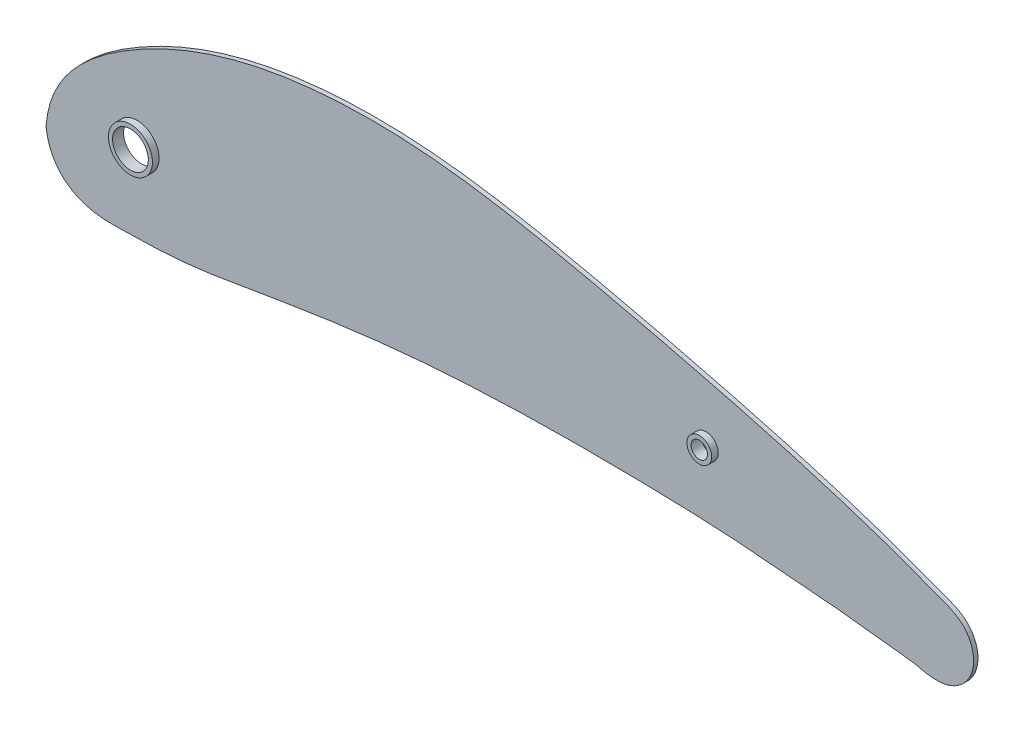
from build123d import *

# Parameters (mm, degrees)
BOSS_EXTRUDE1_DEPTH = 1.5875
SKETCH2_R           = 4.5
SKETCH2_R_2         = 3
SKETCH2_R_3         = 8
SKETCH2_R_4         = 6.5
BOSS_EXTRUDE2_DEPTH = 2.412500128
CUT_EXTRUDE1_START  = -4
SKETCH2_4_R         = 6.5
SKETCH2_4_R_2       = 5.75
SKETCH2_4_R_3       = 3
CUT_EXTRUDE1_DEPTH  = 4
SKETCH3_R           = 3
SKETCH3_R_2         = 6.5
BOSS_EXTRUDE3_DEPTH = 1.5875


with BuildPart() as part:
    # Sketch1 → Boss-Extrude1 (new body)
    with BuildSketch(Plane.XY):
        with BuildLine():
            add(Edge.make_bspline(
                [(0.000560351, 0.000130087), (0.810633127, 7.359196055), (8.649092025, 17.856605174), (26.286719818, 29.975176328), (52.111128271, 42.069215275), (89.597618475, 49.290763054), (131.400792109, 47.884831915), (173.256699242, 40.041104278), (217.961060472, 29.612974894), (256.952064401, 19.528920948), (290.35983767, 8.71099439), (301.273197721, 4.382828139), (314.816918223, -0.516206742), (309.846313895, 0.000130087)],
                knots=[0, 0, 0, 0, 0.060863618, 0.113688265, 0.188608742, 0.312908923, 0.448482434, 0.557612135, 0.691544113, 0.852438279, 0.92975597, 0.976058229, 1, 1, 1, 1], degree=3))
            add(Edge.make_bspline(
                [(309.846313895, 0.000130087), (303.956832565, 1.47095521), (293.989507544, 2.093987313), (276.26402299, 4.514356704), (260.846344817, 5.427413394), (235.858814759, 7.870306192), (205.101424636, 8.838080282), (157.718638092, 9.030650149), (110.497331172, 6.181495223), (66.506197185, -0.586669107), (36.454672816, -6.098499901), (15.316603331, -6.189065841), (1.230714189, -6.924076091), (0.000560351, 0.000130087)],
                knots=[0, 0, 0, 0, 0.057787081, 0.095274891, 0.171021118, 0.205339302, 0.335319146, 0.464904334, 0.658702312, 0.785511947, 0.893517288, 0.94309214, 1, 1, 1, 1], degree=3))
        make_face()
    extrude(amount=BOSS_EXTRUDE1_DEPTH)

    # Sketch2 → Boss-Extrude2 (add)
    # profile 1 of 2: a face of its own
    with BuildSketch(Plane.XY.offset(1.5875)):
        with Locations(Location((227.296313895, 19.050130087, 0), (0, 0, 180))):
            Circle(SKETCH2_R)
        with Locations((227.296313895, 19.050130087)):
            Circle(SKETCH2_R_2, mode=Mode.SUBTRACT)
    # profile 2 of 2: a face of its own
    with BuildSketch(Plane.XY.offset(1.5875)):
        with Locations(Location((20.32, 10.16, 0), (0, 0, 180))):
            Circle(SKETCH2_R_3)
        with Locations((20.32, 10.16)):
            Circle(SKETCH2_R_4, mode=Mode.SUBTRACT)
    extrude(amount=BOSS_EXTRUDE2_DEPTH)

    # Sketch2<4> → Cut-Extrude1 (cut)
    # profile 1 of 3: a face of its own
    with BuildSketch(Plane.XY.offset(1.5875).offset(CUT_EXTRUDE1_START)):
        with Locations(Location((20.32, 10.16, 0), (0, 0, 180))):
            Circle(SKETCH2_4_R)
        with Locations((20.32, 10.16)):
            Circle(SKETCH2_4_R_2, mode=Mode.SUBTRACT)
    # profile 2 of 3: a face of its own
    with BuildSketch(Plane.XY.offset(1.5875).offset(CUT_EXTRUDE1_START)):
        with Locations((20.32, 10.16)):
            Circle(SKETCH2_4_R_2)
    # profile 3 of 3: a face of its own
    with BuildSketch(Plane.XY.offset(1.5875).offset(CUT_EXTRUDE1_START)):
        with Locations(Location((227.296313895, 19.050130087, 0), (0, 0, 180))):
            Circle(SKETCH2_4_R_3)
    extrude(amount=CUT_EXTRUDE1_DEPTH, mode=Mode.SUBTRACT)

    # Sketch3 → Boss-Extrude3 (add)
    with BuildSketch(Plane(origin=(0, 0, 0), x_dir=(-1, 0, 0), z_dir=(0, 0, -1))):
        with BuildLine():
            add(Edge.make_bspline(
                [(-307.640659198, -12.539087546), (-307.217558356, -12.433423344), (-306.794698745, -12.325307987), (-305.94757969, -12.12330096), (-305.523307874, -12.029535003), (-304.248687144, -11.766580558), (-303.396542737, -11.615636043), (-300.835174159, -11.21295058), (-299.121107841, -11.010410608), (-295.688964286, -10.646085532), (-293.970839392, -10.484784679), (-291.395439154, -10.22467467), (-290.537293617, -10.134707532), (-288.822043271, -9.944198445), (-287.964861558, -9.844437915), (-285.39405881, -9.537612889), (-283.681197538, -9.322828465), (-280.253975137, -8.908499626), (-278.539352749, -8.711609867), (-273.38915432, -8.185272474), (-269.948888995, -7.903472556), (-263.065636854, -7.367525768), (-259.622642312, -7.113457385), (-252.743642855, -6.534299134), (-249.308438171, -6.201078142), (-242.431016007, -5.605893048), (-238.987786484, -5.354212306), (-232.093485223, -4.930535427), (-228.641544528, -4.75746758), (-218.28592219, -4.32759383), (-211.381766601, -4.15969745), (-197.573132458, -3.918001938), (-190.668647472, -3.846076469), (-176.859186388, -3.845312431), (-169.95421005, -3.916543553), (-156.143612339, -4.246938801), (-149.234937909, -4.505545645), (-135.436938869, -5.236314206), (-128.547026917, -5.708365191), (-114.787919071, -6.895625055), (-107.918875215, -7.612618486), (-94.20369313, -9.315463639), (-87.358999715, -10.294378281), (-77.115816219, -11.889039149), (-73.704718185, -12.441665778), (-66.887436207, -13.578332899), (-63.482024188, -14.167402421), (-53.261994425, -15.909749635), (-46.44242034, -17.028905731), (-37.85333306, -17.987330435), (-36.13227452, -18.1567188), (-32.688374655, -18.439324462), (-30.964736841, -18.550600806), (-25.789066845, -18.799813385), (-22.332836764, -18.861587488), (-18.013816177, -18.964564881), (-17.150036808, -18.986391339), (-15.422588421, -19.035533108), (-14.558961918, -19.064963111), (-12.831389771, -19.107949046), (-11.967435293, -19.121065622), (-10.238782943, -19.110322287), (-9.374285952, -19.086464893), (-6.799982642, -18.935774333), (-5.1040529, -18.729672307), (-2.60606507, -18.181294881), (-1.781028788, -17.958760916), (-0.556909532, -17.554948104), (-0.151110885, -17.40866523), (0.655628102, -17.090782411), (1.058151158, -16.918409424), (3.033598156, -15.999239459), (4.496819541, -15.083862947), (6.165080649, -13.692542546), (6.491819622, -13.400643282), (7.122036025, -12.797069108), (7.425020518, -12.486058415), (8.298329375, -11.525908236), (8.833114996, -10.8497312), (9.565071132, -9.782041168), (9.797325866, -9.417219923), (10.238211241, -8.669604442), (10.447401936, -8.285671349), (11.035029394, -7.114520562), (11.370477668, -6.315183997), (11.937470931, -4.682242599), (12.168952201, -3.848616751), (12.442464761, -2.573867952), (12.517450612, -2.143613721), (12.670167609, -1.284010684), (12.746526108, -0.854209165), (12.822884607, -0.424407646)],
                knots=[0, 0, 0, 0, 0.00390625, 0.00390625, 0.0078125, 0.0078125, 0.015625, 0.015625, 0.03125, 0.03125, 0.046875, 0.046875, 0.0546875, 0.0546875, 0.0625, 0.0625, 0.078125, 0.078125, 0.09375, 0.09375, 0.125, 0.125, 0.15625, 0.15625, 0.1875, 0.1875, 0.21875, 0.21875, 0.25, 0.25, 0.3125, 0.3125, 0.375, 0.375, 0.4375, 0.4375, 0.5, 0.5, 0.5625, 0.5625, 0.625, 0.625, 0.6875, 0.6875, 0.71875, 0.71875, 0.75, 0.75, 0.8125, 0.8125, 0.828125, 0.828125, 0.84375, 0.84375, 0.875, 0.875, 0.8828125, 0.8828125, 0.890625, 0.890625, 0.8984375, 0.8984375, 0.90625, 0.90625, 0.921875, 0.921875, 0.9296875, 0.9296875, 0.93359375, 0.93359375, 0.9375, 0.9375, 0.953125, 0.953125, 0.95703125, 0.95703125, 0.9609375, 0.9609375, 0.96875, 0.96875, 0.97265625, 0.97265625, 0.9765625, 0.9765625, 0.984375, 0.984375, 0.9921875, 0.9921875, 0.99609375, 0.99609375, 1, 1, 1, 1], degree=3))
            add(Edge.make_bspline(
                [(12.822884607, -0.424407646), (12.765139792, 0.100172261), (12.707394977, 0.624752169), (12.591905347, 1.673911984), (12.52891567, 2.197119212), (12.297914412, 3.755740267), (12.098640002, 4.782972021), (11.366701381, 7.829566749), (10.700090591, 9.813873371), (9.645780575, 12.236404594), (9.423338741, 12.719055064), (8.958881373, 13.673430352), (8.23447829, 15.08562207), (7.430656328, 16.442308561), (5.726221645, 19.088035245), (4.460833832, 20.761627444), (2.403164216, 23.160481023), (1.688839251, 23.943369949), (0.222028874, 25.466851836), (-2.030148044, 27.684033496), (-4.41064195, 29.733189538), (-9.316761854, 33.641457343), (-12.781484695, 35.992965612), (-18.164651713, 39.27656059), (-19.990377965, 40.333355187), (-23.666133339, 42.357961339), (-25.520275615, 43.327279207), (-31.130467721, 46.108995357), (-34.93418714, 47.795409072), (-46.531537172, 52.362569414), (-54.515154512, 54.741205672), (-63.744755219, 56.761657049), (-64.774723341, 56.977238408), (-66.834788658, 57.389176151), (-69.925830231, 57.978474657), (-73.019609651, 58.484766764), (-79.210596391, 59.393423564), (-83.34248448, 59.860835126), (-95.750370075, 60.892542115), (-104.038590609, 61.086258338), (-116.492008775, 60.737503457), (-120.646670589, 60.514458534), (-126.883586466, 60.030630314), (-128.963379302, 59.844466803), (-133.124550465, 59.424070644), (-135.207540526, 59.189544115), (-145.594970482, 57.905779676), (-153.832792977, 56.524741453), (-166.132564079, 54.17356844), (-170.223049115, 53.343512008), (-178.393757628, 51.633027655), (-182.473713838, 50.751287787), (-194.700002507, 48.039407471), (-202.832778155, 46.142719954), (-215.014339388, 43.211283588), (-219.072180538, 42.2209863), (-227.182053622, 40.211875691), (-231.232225779, 39.191799725), (-243.36199815, 36.064182322), (-251.420235834, 33.887176959), (-263.448276276, 30.428836901), (-267.447887219, 29.244406312), (-275.426612854, 26.808913408), (-279.40618455, 25.559336773), (-285.35715209, 23.625187338), (-287.337685563, 22.970320262), (-291.290499883, 21.633757462), (-293.262858235, 20.952313697), (-297.195026702, 19.548632822), (-299.153208366, 18.821101737), (-303.064502528, 17.349560104), (-305.0190352, 16.610166429), (-307.955050529, 15.51478285), (-308.934285457, 15.151485754), (-310.893891195, 14.428584226), (-311.875164589, 14.071914027), (-313.831366034, 13.337945403), (-314.808049131, 12.961388245), (-316.719156906, 12.12649388), (-317.652282104, 11.663851008), (-318.978024645, 10.820880812), (-319.408221872, 10.51489925), (-320.225847261, 9.859622762), (-320.615306755, 9.509314527), (-321.353583055, 8.761089941), (-321.699471113, 8.365825169), (-322.336708966, 7.543445692), (-322.629515882, 7.114906521), (-323.16319448, 6.222920138), (-323.404365456, 5.758838065), (-323.831166845, 4.79677466), (-324.194764938, 3.818521185), (-324.436422233, 2.809031523), (-324.571585545, 2.040110573), (-324.608939896, 1.781831147), (-324.667931422, 1.261246203), (-324.689573785, 0.998141034), (-324.756720117, -0.310913388), (-324.682639527, -1.346678633), (-324.382280636, -2.883329873), (-324.249021416, -3.39559158), (-323.924248204, -4.388644661), (-323.541036888, -5.35507277), (-323.0431311, -6.269244957), (-322.625572759, -6.934768493), (-322.478484529, -7.153933608), (-322.172908527, -7.580241987), (-322.014249177, -7.787766025), (-321.192214147, -8.79782852), (-320.443866507, -9.518885707), (-318.761163886, -10.782634014), (-317.8577056, -11.301394678), (-316.421060308, -11.913302637), (-315.925392414, -12.090300006), (-314.917821884, -12.383866446), (-314.409413715, -12.499760473), (-313.383993339, -12.674058303), (-312.866960582, -12.732324794), (-311.825105731, -12.796811206), (-311.298814045, -12.802807669), (-310.250395164, -12.774737499), (-309.727518722, -12.741201694), (-308.683355881, -12.650868989), (-308.162125238, -12.593256437), (-307.640659198, -12.539087546)],
                knots=[0, 0, 0, 0, 0.00390625, 0.00390625, 0.0078125, 0.0078125, 0.015625, 0.015625, 0.03125, 0.03125, 0.03515625, 0.03515625, 0.0390625, 0.046875, 0.046875, 0.0625, 0.0625, 0.0703125, 0.0703125, 0.078125, 0.09375, 0.09375, 0.125, 0.125, 0.140625, 0.140625, 0.15625, 0.15625, 0.1875, 0.1875, 0.25, 0.25, 0.2578125, 0.2578125, 0.265625, 0.28125, 0.28125, 0.3125, 0.3125, 0.375, 0.375, 0.40625, 0.40625, 0.421875, 0.421875, 0.4375, 0.4375, 0.5, 0.5, 0.53125, 0.53125, 0.5625, 0.5625, 0.625, 0.625, 0.65625, 0.65625, 0.6875, 0.6875, 0.75, 0.75, 0.78125, 0.78125, 0.8125, 0.8125, 0.828125, 0.828125, 0.84375, 0.84375, 0.859375, 0.859375, 0.875, 0.875, 0.8828125, 0.8828125, 0.890625, 0.890625, 0.8984375, 0.8984375, 0.90625, 0.90625, 0.91015625, 0.91015625, 0.9140625, 0.9140625, 0.91796875, 0.91796875, 0.921875, 0.921875, 0.92578125, 0.92578125, 0.9296875, 0.93359375, 0.93359375, 0.935546875, 0.935546875, 0.9375, 0.9375, 0.9453125, 0.9453125, 0.94921875, 0.94921875, 0.953125, 0.95703125, 0.95703125, 0.958984375, 0.958984375, 0.9609375, 0.9609375, 0.96875, 0.96875, 0.9765625, 0.9765625, 0.98046875, 0.98046875, 0.984375, 0.984375, 0.98828125, 0.98828125, 0.9921875, 0.9921875, 0.99609375, 0.99609375, 1, 1, 1, 1], degree=3))
        make_face()
        with Locations((-227.296313895, 19.050130087)):
            Circle(SKETCH3_R, mode=Mode.SUBTRACT)
        with Locations((-20.32, 10.16)):
            Circle(SKETCH3_R_2, mode=Mode.SUBTRACT)
    extrude(amount=-BOSS_EXTRUDE3_DEPTH)


solid = part.part
